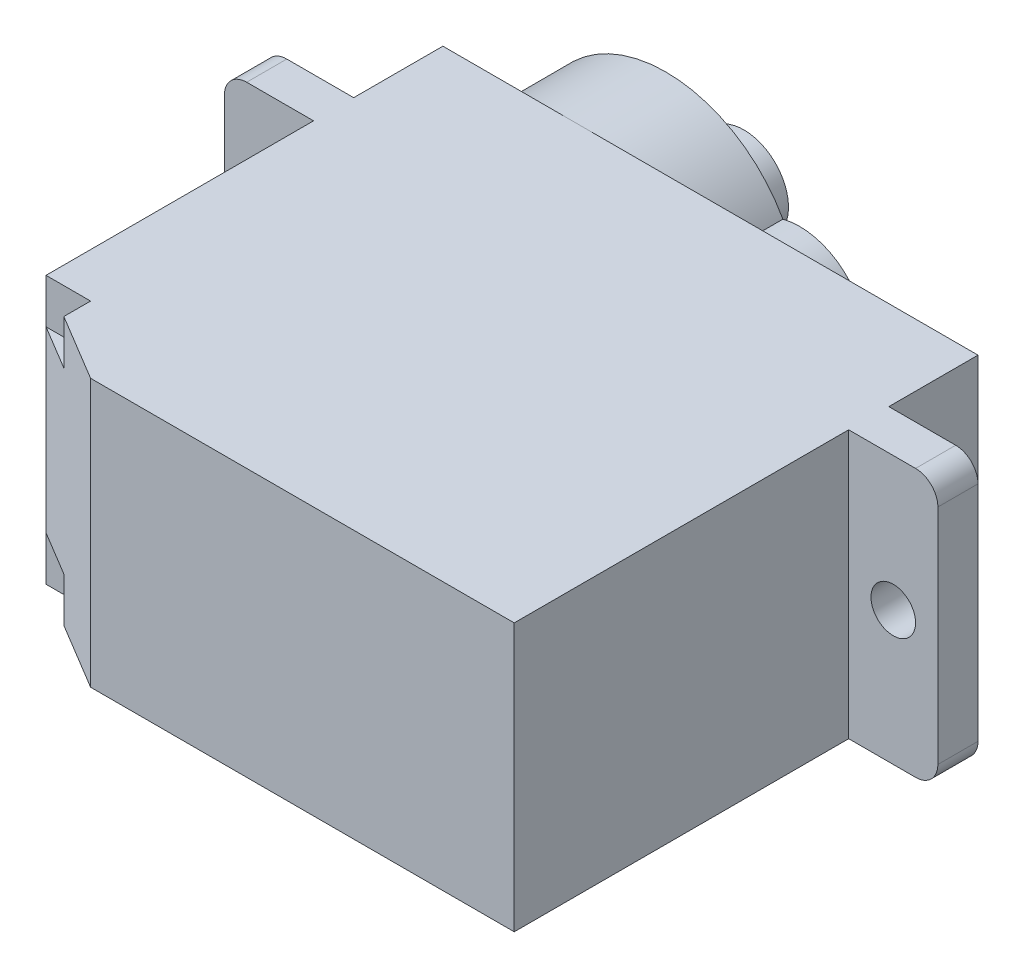
from build123d import *

# Parameters (mm, degrees)
SKETCH_1_W          = 24
SKETCH_1_H          = 12
EXTRUDE_1_DEPTH     = 12
SKETCH_2_R          = 1
EXTRUDE_2_DEPTH     = 1.8
SKETCH_3_W          = 24
SKETCH_3_H          = 12
EXTRUDE_3_DEPTH     = 4
EXTRUDE_4_DEPTH     = 4
SKETCH_5_R          = 2
EXTRUDE_5_DEPTH     = 3.5
EXTRUDE_6_DEPTH     = 3
CUT_EXTRUDE_1_DEPTH = 12


with BuildPart() as part:
    # Эскиз1 → Бобышка-Вытянуть1 (new body)
    with BuildSketch(Plane.XY):
        Rectangle(SKETCH_1_W, SKETCH_1_H)
    extrude(amount=EXTRUDE_1_DEPTH)

    # Эскиз2 → Бобышка-Вытянуть2 (add)
    with BuildSketch(Plane(origin=(0, 0, 0), x_dir=(-1, 0, 0), z_dir=(0, 0, -1))):
        with BuildLine():
            Line((12, 6), (15, 6))
            ThreePointArc((15, 6), (15.707106781, 5.707106781), (16, 5))
            Line((16, 5), (16, -5))
            ThreePointArc((16, -5), (15.707106781, -5.707106781), (15, -6))
            Line((15, -6), (12, -6))
            Line((12, -6), (-12, -6))
            Line((-12, -6), (-15, -6))
            ThreePointArc((-15, -6), (-15.707106781, -5.707106781), (-16, -5))
            Line((-16, -5), (-16, 5))
            ThreePointArc((-16, 5), (-15.707106781, 5.707106781), (-15, 6))
            Line((-15, 6), (-12, 6))
            Line((-12, 6), (12, 6))
        make_face()
        with Locations((14, 0)):
            Circle(SKETCH_2_R, mode=Mode.SUBTRACT)
        with Locations((-14, 0)):
            Circle(SKETCH_2_R, mode=Mode.SUBTRACT)
    extrude(amount=EXTRUDE_2_DEPTH)

    # Эскиз3 → Бобышка-Вытянуть3 (add)
    with BuildSketch(Plane(origin=(0, 0, -1.8), x_dir=(-1, 0, 0), z_dir=(0, 0, -1))):
        Rectangle(SKETCH_3_W, SKETCH_3_H)
    extrude(amount=EXTRUDE_3_DEPTH)

    # Эскиз4 → Бобышка-Вытянуть4 (add)
    with BuildSketch(Plane(origin=(0, 0, -5.8), x_dir=(-1, 0, 0), z_dir=(0, 0, -1))):
        with BuildLine():
            ThreePointArc((0.75, 2.90473751), (12, 0), (0.75, -2.90473751))
            ThreePointArc((0.75, -2.90473751), (-3, 0), (0.75, 2.90473751))
        make_face()
    extrude(amount=EXTRUDE_4_DEPTH)

    # Эскиз5 → Бобышка-Вытянуть5 (add)
    with BuildSketch(Plane(origin=(0, 0, -9.8), x_dir=(-1, 0, 0), z_dir=(0, 0, -1))):
        with Locations((6, 0)):
            Circle(SKETCH_5_R)
    extrude(amount=EXTRUDE_5_DEPTH)

    # Эскиз6 → Бобышка-Вытянуть6 (add)
    with BuildSketch(Plane.XY.offset(12)):
        Polygon((12, -6), (12, 6), (-10, 6), (-10, 4), (-12, 4), (-12, -4), (-10, -4), (-10, -6), align=None)
    extrude(amount=EXTRUDE_6_DEPTH)

    # Эскиз8 → Вырез-Вытянуть1 (cut)
    with BuildSketch(Plane(origin=(0, 6, 0), x_dir=(1, 0, 0), z_dir=(0, 1, 0))):
        Polygon((-7, -15), (-12, -12), (-12, -15), align=None)
    extrude(amount=-CUT_EXTRUDE_1_DEPTH, mode=Mode.SUBTRACT)


solid = part.part
